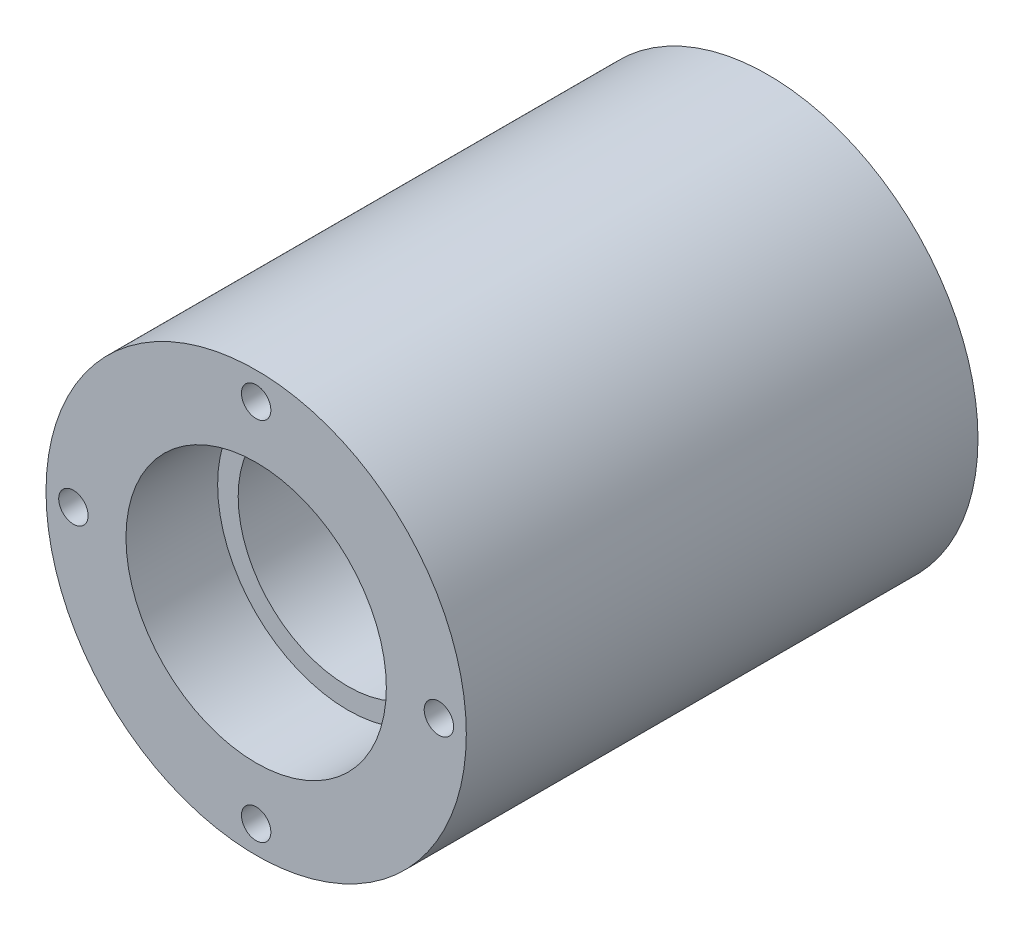
from build123d import *

# Parameters (mm, degrees)
SKETCH1_R                                 = 36.5125
SKETCH1_R_2                               = 19.05
EXTRUDE1_DEPTH                            = 44.45
SKETCH3_R                                 = 22.6187
OUTER_RACE_POCKET_MASTER_DEPTH            = 15.9258
F_1_4_20_THREAD_PATTERN_MASTER_AT_2_COUNT = 2
F_1_4_20_THREAD_PATTERN_MASTER_AT_2_PITCH = 44.901280605
F_1_4_20_THREAD_PATTERN_MASTER_AT_3_COUNT = 2
F_1_4_20_THREAD_PATTERN_MASTER_AT_3_PITCH = 63.5
F_1_4_20_THREAD_PATTERN_MASTER_AT_4_COUNT = 2
F_1_4_20_THREAD_PATTERN_MASTER_AT_4_PITCH = 44.901280605


with BuildPart() as part:
    # Sketch1 → Extrude1 (new, symmetric)
    with BuildSketch(Plane.XY):
        Circle(SKETCH1_R)
        Circle(SKETCH1_R_2, mode=Mode.SUBTRACT)
    extrude(amount=EXTRUDE1_DEPTH, both=True)

    # Sketch3 → Outer race pocket master (cut)
    with BuildSketch(Plane.XY.offset(44.45)):
        Circle(SKETCH3_R)
    outer_race_pocket_master = extrude(amount=-OUTER_RACE_POCKET_MASTER_DEPTH, mode=Mode.SUBTRACT)

    # Sketch8 → 1/4-20 thread pattern master (revolve, cut)
    with BuildSketch(Plane(origin=(0, 31.75, 44.45), x_dir=(0, -1, 0), z_dir=(1, 0, 0))):
        Polygon((0, 0), (0, 11.058816902), (2.5527, 9.525), (2.5527, 0), align=None)
    f_1_4_20_thread_pattern_master = revolve(axis=Axis((0, 31.75, 50.8), (0, 0, -1)), mode=Mode.SUBTRACT)

    # 1/4-20 thread pattern master at 2: 1/4-20 thread pattern master ×2
    with Locations(*[Vector(0.7071067811865476, -0.7071067811865476, 0) * (i * F_1_4_20_THREAD_PATTERN_MASTER_AT_2_PITCH) for i in range(1, F_1_4_20_THREAD_PATTERN_MASTER_AT_2_COUNT)]):
        add(f_1_4_20_thread_pattern_master, mode=Mode.SUBTRACT)

    # 1/4-20 thread pattern master at 3: 1/4-20 thread pattern master ×2
    with Locations(*[(0, -i * F_1_4_20_THREAD_PATTERN_MASTER_AT_3_PITCH, 0) for i in range(1, F_1_4_20_THREAD_PATTERN_MASTER_AT_3_COUNT)]):
        add(f_1_4_20_thread_pattern_master, mode=Mode.SUBTRACT)

    # 1/4-20 thread pattern master at 4: 1/4-20 thread pattern master ×2
    with Locations(*[Vector(-0.7071067811865476, -0.7071067811865476, 0) * (i * F_1_4_20_THREAD_PATTERN_MASTER_AT_4_PITCH) for i in range(1, F_1_4_20_THREAD_PATTERN_MASTER_AT_4_COUNT)]):
        add(f_1_4_20_thread_pattern_master, mode=Mode.SUBTRACT)

    # Pocket and thread mirror: Outer race pocket master, 1/4-20 thread pattern master across plane
    add(outer_race_pocket_master.mirror(Plane.XY), mode=Mode.SUBTRACT)
    add(f_1_4_20_thread_pattern_master.mirror(Plane.XY), mode=Mode.SUBTRACT)

    # Pocket and thread mirror copy 1 sketch → Pocket and thread mirror copy 1 (revolve, cut)
    with BuildSketch(Plane(origin=(31.75, 0, -44.45), x_dir=(0, -1, 0), z_dir=(1, 0, 0))):
        Polygon((0, 0), (0, -11.058816902), (2.5527, -9.525), (2.5527, 0), align=None)
    revolve(axis=Axis((31.75, 0, -50.8), (0, 0, -1)), mode=Mode.SUBTRACT)

    # Pocket and thread mirror copy 2 sketch → Pocket and thread mirror copy 2 (revolve, cut)
    with BuildSketch(Plane(origin=(0, -31.75, -44.45), x_dir=(0, -1, 0), z_dir=(1, 0, 0))):
        Polygon((0, 0), (0, -11.058816902), (2.5527, -9.525), (2.5527, 0), align=None)
    revolve(axis=Axis((0, -31.75, -50.8), (0, 0, -1)), mode=Mode.SUBTRACT)

    # Pocket and thread mirror copy 3 sketch → Pocket and thread mirror copy 3 (revolve, cut)
    with BuildSketch(Plane(origin=(-31.75, 0, -44.45), x_dir=(0, -1, 0), z_dir=(1, 0, 0))):
        Polygon((0, 0), (0, -11.058816902), (2.5527, -9.525), (2.5527, 0), align=None)
    revolve(axis=Axis((-31.75, 0, -50.8), (0, 0, -1)), mode=Mode.SUBTRACT)


solid = part.part
